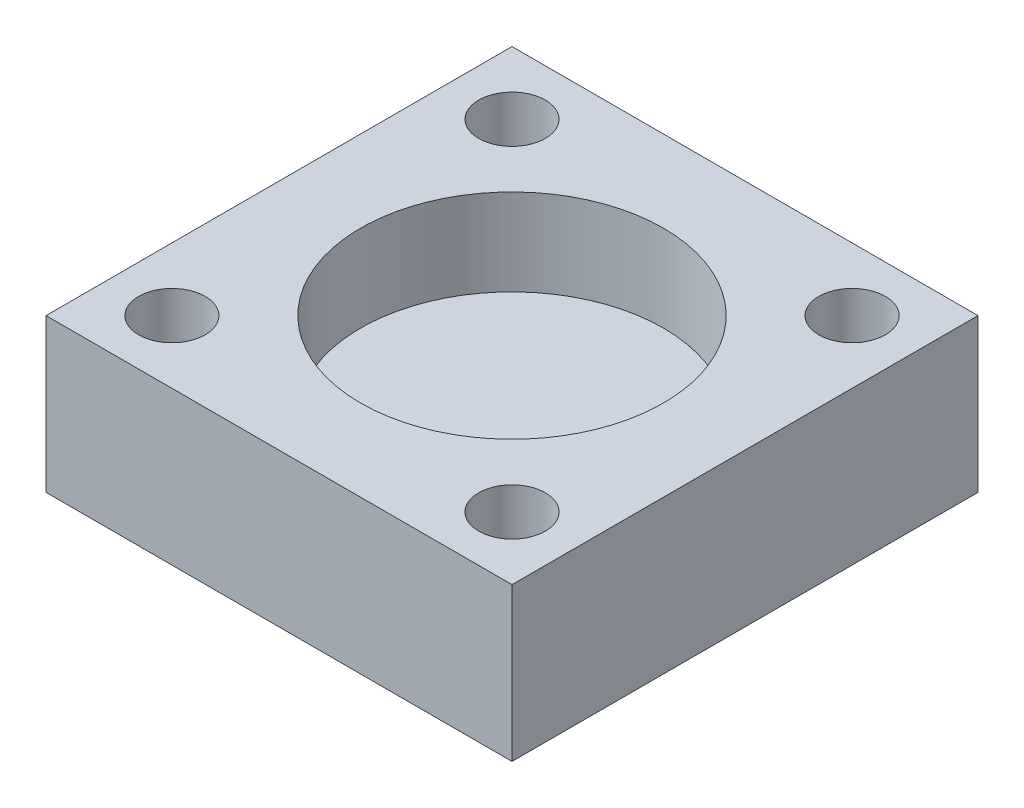
from build123d import *

# Parameters (mm, degrees)
SKETCH2_W           = 28
SKETCH2_H           = 28
SKETCH2_R           = 9.1
BOSS_EXTRUDE1_DEPTH = 5.2
SKETCH2_4_W         = 28
SKETCH2_4_H         = 28
BOSS_EXTRUDE2_DEPTH = 4
SKETCH3_R           = 2
CUT_EXTRUDE1_DEPTH  = 22.832086478
FILLET1_R           = 1


with BuildPart() as part:
    # Sketch2 → Boss-Extrude1 (new body)
    with BuildSketch(Plane(origin=(0, 0, 0), x_dir=(1, 0, 0), z_dir=(0, 1, 0))):
        Rectangle(SKETCH2_W, SKETCH2_H)
        Circle(SKETCH2_R, mode=Mode.SUBTRACT)
    extrude(amount=BOSS_EXTRUDE1_DEPTH)

    # Sketch2<4> → Boss-Extrude2 (add)
    with BuildSketch(Plane(origin=(0, 0, 0), x_dir=(1, 0, 0), z_dir=(0, 1, 0))):
        Rectangle(SKETCH2_4_W, SKETCH2_4_H)
    extrude(amount=-BOSS_EXTRUDE2_DEPTH)

    # Sketch3 → Cut-Extrude1 (cut, through all)
    with BuildSketch(Plane(origin=(0, 5.2, 0), x_dir=(1, 0, 0), z_dir=(0, 1, 0))):
        with Locations((-10.217335854, 10.217335854)):
            Circle(SKETCH3_R)
        with Locations((-10.217335854, -10.217335854)):
            Circle(SKETCH3_R)
        with Locations((10.217335854, -10.217335854)):
            Circle(SKETCH3_R)
        with Locations((10.217335854, 10.217335854)):
            Circle(SKETCH3_R)
    extrude(amount=-CUT_EXTRUDE1_DEPTH, mode=Mode.SUBTRACT)

    # Fillet1
    fillet1_edges = [part.edges().sort_by_distance(p)[0] for p in [
        (8.217335854, -4, 10.217335854),
        (8.217335854, -4, -10.217335854),
        (-12.217335854, -4, 10.217335854),
        (-12.217335854, -4, -10.217335854),
    ]]
    fillet(fillet1_edges, radius=FILLET1_R)


solid = part.part
